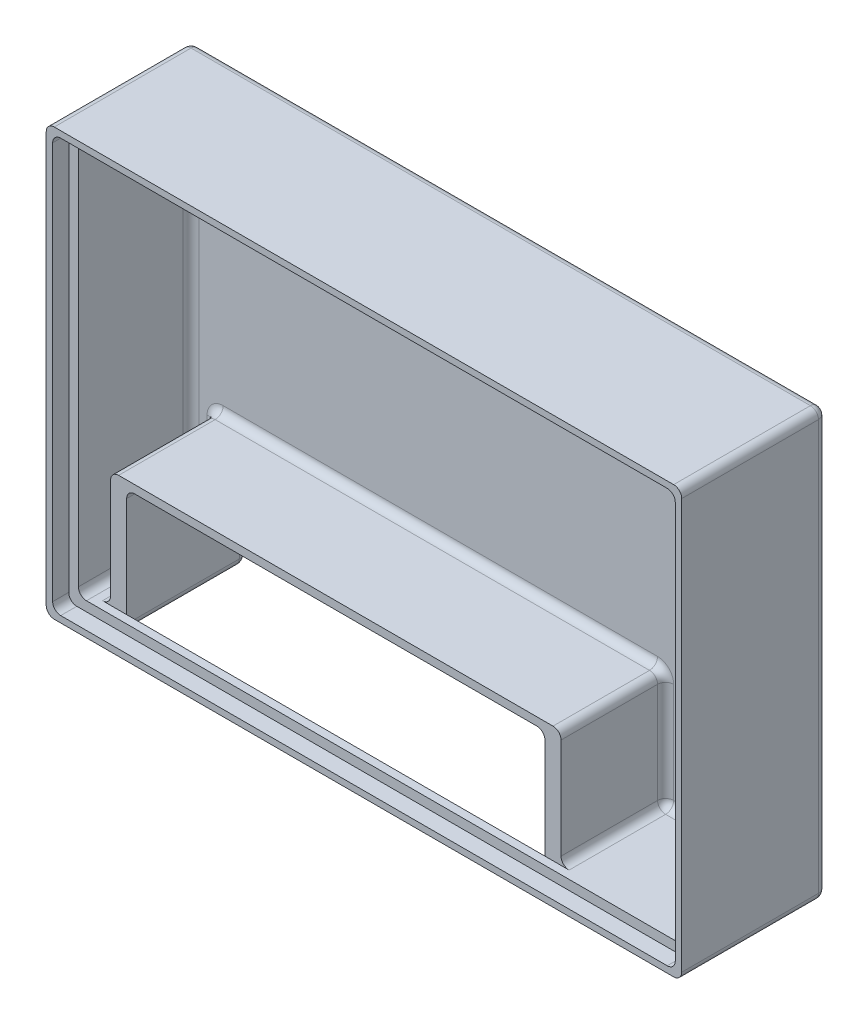
from build123d import *

# Parameters (mm, degrees)
SKETCH1_W           = 79
SKETCH1_H           = 53
BOSS_EXTRUDE1_DEPTH = 2
SKETCH2_W           = 79
SKETCH2_H           = 53
SKETCH2_W_2         = 75
SKETCH2_H_2         = 49
BOSS_EXTRUDE2_DEPTH = 14
SKETCH3_W           = 79
SKETCH3_H           = 53
SKETCH3_W_2         = 77.4
SKETCH3_H_2         = 51.4
BOSS_EXTRUDE3_DEPTH = 2
SKETCH5_W           = 15
SKETCH5_H           = 16.5
CUT_EXTRUDE2_DEPTH  = 54
SKETCH6_W           = 15
SKETCH6_H           = 16.5
BOSS_EXTRUDE4_DEPTH = 2
SKETCH7_W           = 54
SKETCH7_H           = 15
BOSS_EXTRUDE6_DEPTH = 1
SKETCH8_W           = 15
SKETCH8_H           = 15.5
BOSS_EXTRUDE8_DEPTH = 2
FILLET1_R           = 1


with BuildPart() as part:
    # Sketch1 → Boss-Extrude1 (new body)
    with BuildSketch(Plane.XY):
        with Locations((39.5, 26.5)):
            Rectangle(SKETCH1_W, SKETCH1_H)
    extrude(amount=BOSS_EXTRUDE1_DEPTH)

    # Sketch2 → Boss-Extrude2 (add)
    with BuildSketch(Plane.XY.offset(2)):
        with Locations((39.5, 26.5)):
            Rectangle(SKETCH2_W, SKETCH2_H)
        with Locations((39.5, 26.5)):
            Rectangle(SKETCH2_W_2, SKETCH2_H_2, mode=Mode.SUBTRACT)
    extrude(amount=BOSS_EXTRUDE2_DEPTH)

    # Sketch3 → Boss-Extrude3 (add)
    with BuildSketch(Plane.XY.offset(16)):
        with Locations((39.5, 26.5)):
            Rectangle(SKETCH3_W, SKETCH3_H)
        with Locations((39.5, 26.5)):
            Rectangle(SKETCH3_W_2, SKETCH3_H_2, mode=Mode.SUBTRACT)
    extrude(amount=BOSS_EXTRUDE3_DEPTH)

    # Sketch5 → Cut-Extrude2 (cut)
    with BuildSketch(Plane.ZY.offset(-5)):
        with Locations((7.5, 8.25)):
            Rectangle(SKETCH5_W, SKETCH5_H)
    extrude(amount=-CUT_EXTRUDE2_DEPTH, mode=Mode.SUBTRACT)

    # Sketch6 → Boss-Extrude4 (add)
    with BuildSketch(Plane.ZY.offset(-59)):
        with Locations((7.5, 8.25)):
            Rectangle(SKETCH6_W, SKETCH6_H)
    extrude(amount=-BOSS_EXTRUDE4_DEPTH)

    # Sketch7 → Boss-Extrude6 (add)
    with BuildSketch(Plane.XZ.offset(-16.5)):
        with Locations((32, 7.5)):
            Rectangle(SKETCH7_W, SKETCH7_H)
    extrude(amount=BOSS_EXTRUDE6_DEPTH)

    # Sketch8 → Boss-Extrude8 (add)
    with BuildSketch(Plane(origin=(5, 0, 0), x_dir=(0, 0, -1), z_dir=(1, 0, 0))):
        with Locations((-7.5, 7.75)):
            Rectangle(SKETCH8_W, SKETCH8_H)
    extrude(amount=BOSS_EXTRUDE8_DEPTH)

    # Fillet1
    fillet1_edges = [part.edges().sort_by_distance(p)[0] for p in [
        (59, 7.75, 0),
        (5, 16.5, 8.5),
        (59, 15.5, 7.5),
        (33, 15.5, 0),
        (7, 7.75, 0),
        (7, 15.5, 7.5),
        (7, 0, 7.5),
        (77, 26.5, 2),
        (39.5, 51, 2),
        (2, 26.5, 2),
        (3.5, 2, 2),
        (77, 51, 9),
        (2, 51, 9),
        (2, 2, 9),
        (77, 2, 9),
        (78.2, 52.2, 17),
        (0.8, 52.2, 17),
        (0.8, 0.8, 17),
        (78.2, 0.8, 17),
        (39.5, 53, 0),
        (79, 26.5, 0),
        (3.5, 0, 0),
        (0, 26.5, 0),
        (69, 0, 0),
        (33, 16.5, 2),
        (5, 9.25, 2),
        (59, 0, 7.5),
        (5, 2, 8.5),
        (0, 53, 9),
        (79, 53, 9),
        (79, 0, 9),
        (0, 0, 9),
        (69, 2, 2),
        (61, 9.25, 2),
        (61, 16.5, 8.5),
        (61, 2, 8.5),
    ]]
    fillet(fillet1_edges, radius=FILLET1_R)


solid = part.part
